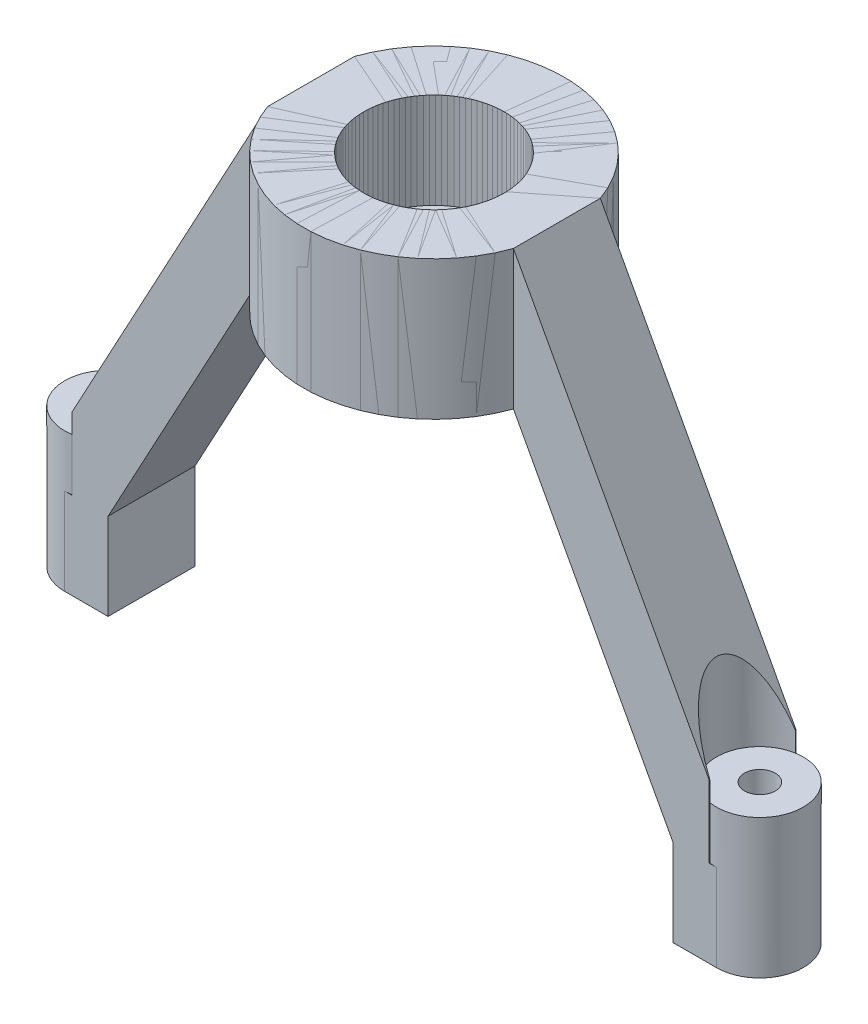
from build123d import *

# Parameters (mm, degrees)
SKETCH1_R                = 1.875
BOSS_EXTRUDE1_DEPTH      = 8
BOSS_EXTRUDE2_START      = -17
SKETCH1_3_R              = 2.5
SKETCH1_3_R_2            = 0.889
BOSS_EXTRUDE2_DEPTH      = 5
SKETCH4_R                = 4.05
CUT_EXTRUDE1_DEPTH       = 5.5
BOSS_EXTRUDE3_DEPTH      = 2.5
BOSS_EXTRUDE3_DEPTH_BACK = 2.5
CUT_EXTRUDE2_DEPTH       = 31.129926983
CUT_EXTRUDE2_DEPTH_BACK  = 2
SKETCH5_R                = 2.5
BOSS_EXTRUDE4_START      = 5
SKETCH8_R                = 0.889
BOSS_EXTRUDE4_DEPTH      = 5
SKETCH1_4_R              = 0.889
CUT_EXTRUDE3_DEPTH       = 32.49305479
CIRPATTERN5_COUNT        = 2


with BuildPart() as part:
    # Sketch1 → Boss-Extrude1 (new body)
    with BuildSketch(Plane(origin=(0, 0, 0), x_dir=(1, 0, 0), z_dir=(0, 1, 0))):
        with BuildLine():
            Line((7.071067812, -2.5), (7.071067812, 2.5))
            ThreePointArc((7.071067812, 2.5), (0, 7.5), (-7.071067812, 2.5))
            Line((-7.071067812, 2.5), (-7.071067812, -2.5))
            ThreePointArc((-7.071067812, -2.5), (0, -7.5), (7.071067812, -2.5))
        make_face()
        Circle(SKETCH1_R, mode=Mode.SUBTRACT)
    extrude(amount=BOSS_EXTRUDE1_DEPTH)

    # Sketch4 → Cut-Extrude1 (cut)
    with BuildSketch(Plane(origin=(0, 8, 0), x_dir=(1, 0, 0), z_dir=(0, 1, 0))):
        Circle(SKETCH4_R)
    extrude(amount=-CUT_EXTRUDE1_DEPTH, mode=Mode.SUBTRACT)



with BuildPart() as body_2:
    # Sketch1<3> → Boss-Extrude2 (new body)
    with BuildSketch(Plane(origin=(0, 0, 0), x_dir=(1, 0, 0), z_dir=(0, 1, 0)).offset(BOSS_EXTRUDE2_START)):
        with Locations((-18.75, 0)):
            Circle(SKETCH1_3_R)
        with Locations((-18.75, 0)):
            Circle(SKETCH1_3_R_2, mode=Mode.SUBTRACT)
    extrude(amount=BOSS_EXTRUDE2_DEPTH)


with BuildPart() as part_1:
    add(part.part)

    add(body_2.part)  # Boss-Extrude3 merges body 2
    # Sketch3 → Boss-Extrude3 (add, two sides: drawn at the far end of the back side and taken through both)
    with BuildSketch(Plane.XY.offset(-BOSS_EXTRUDE3_DEPTH_BACK)):
        Polygon((-7.071067812, 8), (-18.337324626, -12.86586565), (-18.337324626, -17), (-16.25, -17), (-7.071067812, 0), align=None)
    extrude(amount=BOSS_EXTRUDE3_DEPTH + BOSS_EXTRUDE3_DEPTH_BACK)

    # Sketch5 → Cut-Extrude2 (cut, two sides: drawn at the far end of the back side and taken through both)
    with BuildSketch(Plane(origin=(0, -12, 0), x_dir=(1, 0, 0), z_dir=(0, 1, 0)).offset(-CUT_EXTRUDE2_DEPTH_BACK)):
        with Locations((-18.75, 0)):
            Circle(SKETCH5_R)
    extrude(amount=CUT_EXTRUDE2_DEPTH + CUT_EXTRUDE2_DEPTH_BACK, mode=Mode.SUBTRACT)

    # Sketch8 → Boss-Extrude4 (add)
    with BuildSketch(Plane.XZ.offset(17).offset(BOSS_EXTRUDE4_START)):
        with BuildLine():
            Line((-18.75, -2.5), (-16.25, -2.5))
            Line((-16.25, -2.5), (-16.25, 2.5))
            Line((-16.25, 2.5), (-18.75, 2.5))
            ThreePointArc((-18.75, 2.5), (-21.25, 0), (-18.75, -2.5))
        make_face()
        with Locations((-18.75, 0)):
            Circle(SKETCH8_R, mode=Mode.SUBTRACT)
    extrude(amount=-BOSS_EXTRUDE4_DEPTH)

    # Sketch1<4> → Cut-Extrude3 (cut, through all)
    with BuildSketch(Plane(origin=(0, 0, 0), x_dir=(1, 0, 0), z_dir=(0, 1, 0))):
        with Locations((-18.75, 0)):
            Circle(SKETCH1_4_R)
    extrude(amount=-CUT_EXTRUDE3_DEPTH, mode=Mode.SUBTRACT)


with BuildPart() as cirpattern5_1:
    # CirPattern5: pattern copy
    add(part_1.part.rotate(Axis((0, 8, 0), (0, 1, 0)), 1 * 360 / CIRPATTERN5_COUNT))


solid = Compound([part_1.part, cirpattern5_1.part])
